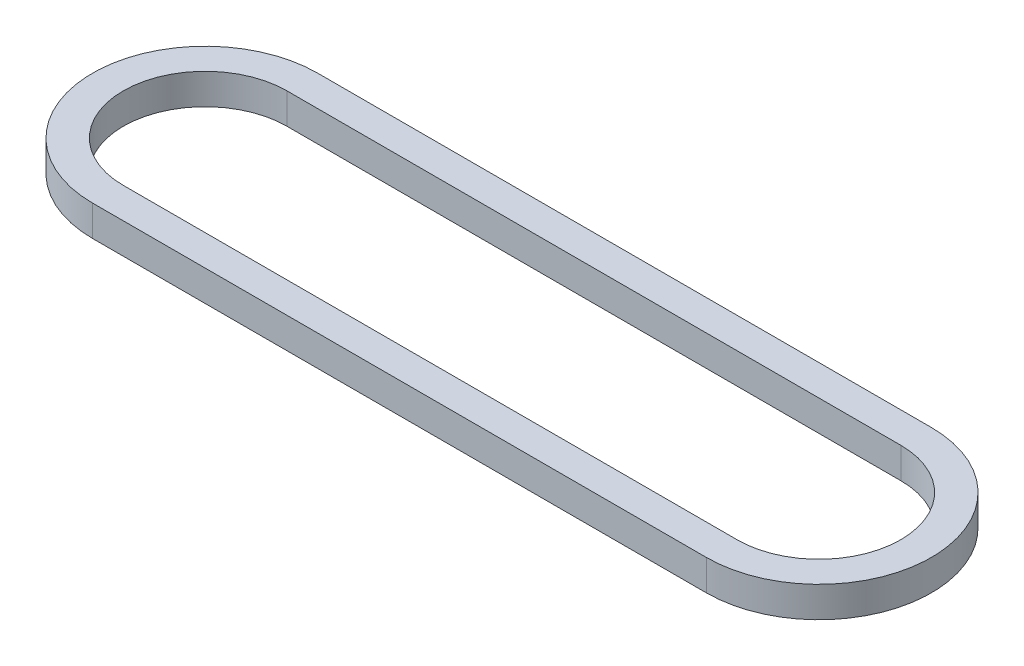
from build123d import *

# Parameters (mm, degrees)
BOSS_EXTRUDE1_DEPTH = 7.62


with BuildPart() as part:
    # Sketch1 → Boss-Extrude1 (new body)
    with BuildSketch(Plane(origin=(0, 0, 0), x_dir=(1, 0, 0), z_dir=(0, 1, 0))):
        with BuildLine():
            Line((-76.2, 27.94), (76.2, 27.94))
            ThreePointArc((76.2, 27.94), (104.14, 0), (76.2, -27.94))
            Line((76.2, -27.94), (-76.2, -27.94))
            ThreePointArc((-76.2, -27.94), (-104.14, 0), (-76.2, 27.94))
        make_face()
        with BuildLine():
            Line((-76.2, 20.32), (76.2, 20.32))
            ThreePointArc((76.2, 20.32), (96.52, 0), (76.2, -20.32))
            Line((76.2, -20.32), (-76.2, -20.32))
            ThreePointArc((-76.2, -20.32), (-96.52, 0), (-76.2, 20.32))
        make_face(mode=Mode.SUBTRACT)
    extrude(amount=BOSS_EXTRUDE1_DEPTH)


solid = part.part
